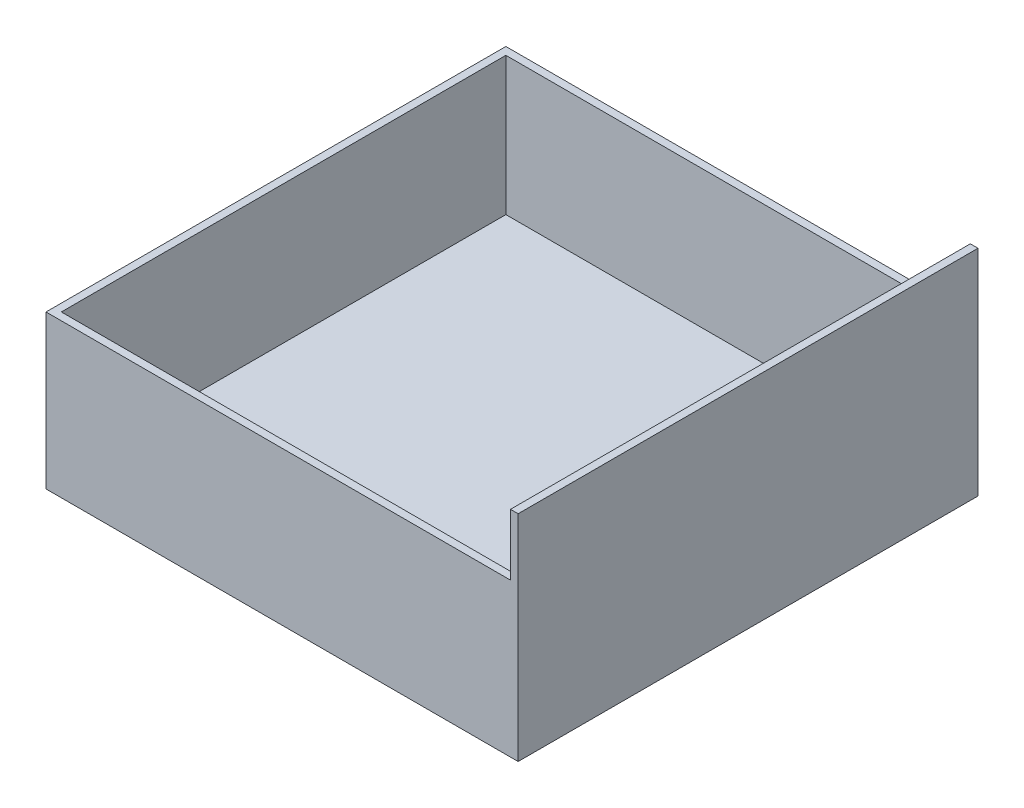
from build123d import *

# Parameters (mm, degrees)
SKETCH1_W           = 78.232
SKETCH1_H           = 76.2
BOSS_EXTRUDE1_DEPTH = 35.56
SKETCH2_W           = 75.692
SKETCH2_H           = 73.66
CUT_EXTRUDE1_DEPTH  = 33.02
CUT_EXTRUDE3_DEPTH  = 10.16


with BuildPart() as part:
    # Sketch1 → Boss-Extrude1 (new body)
    with BuildSketch(Plane(origin=(0, 0, 0), x_dir=(1, 0, 0), z_dir=(0, 1, 0))):
        with Locations((39.116, 0)):
            Rectangle(SKETCH1_W, SKETCH1_H)
    extrude(amount=BOSS_EXTRUDE1_DEPTH)

    # Sketch2 → Cut-Extrude1 (cut)
    with BuildSketch(Plane(origin=(0, 35.56, 0), x_dir=(1, 0, 0), z_dir=(0, 1, 0))):
        with Locations((39.116, 0)):
            Rectangle(SKETCH2_W, SKETCH2_H)
    extrude(amount=-CUT_EXTRUDE1_DEPTH, mode=Mode.SUBTRACT)

    # Sketch11 → Cut-Extrude3 (cut)
    with BuildSketch(Plane(origin=(0, 35.56, 0), x_dir=(1, 0, 0), z_dir=(0, 1, 0))):
        Polygon((76.962, -36.83), (76.962, -38.1), (0, -38.1), (0, 38.1), (76.962, 38.1), (76.962, 36.83), (1.27, 36.83), (1.27, -36.83), align=None)
    extrude(amount=-CUT_EXTRUDE3_DEPTH, mode=Mode.SUBTRACT)


solid = part.part
